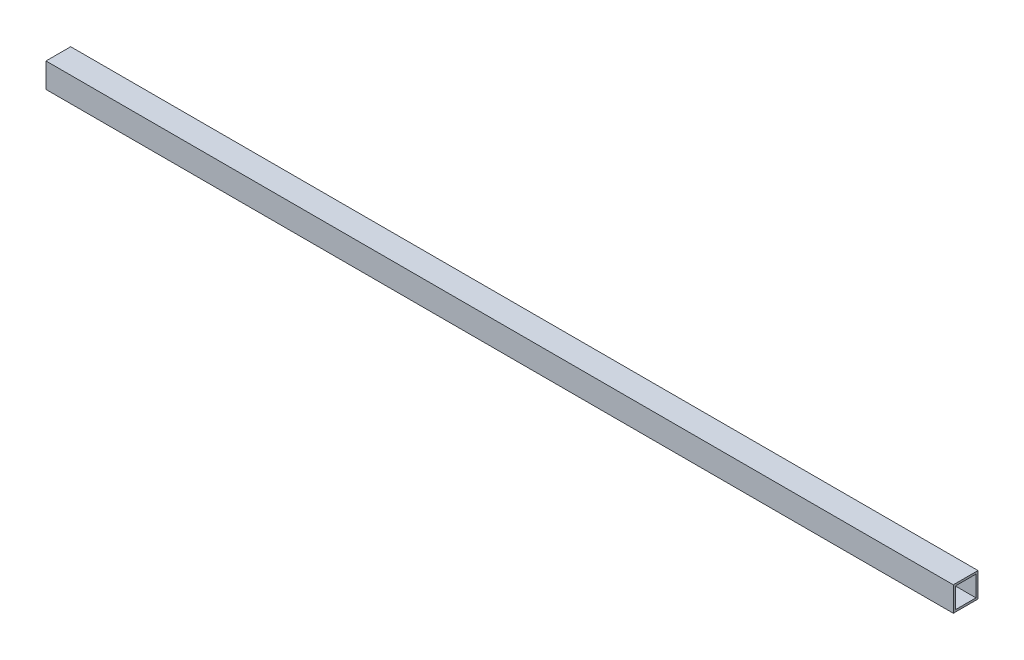
from build123d import *

# Parameters (mm, degrees)
SKETCH1_W           = 19.05
SKETCH1_H           = 19.05
SKETCH1_W_2         = 15.875
SKETCH1_H_2         = 15.875
BOSS_EXTRUDE1_DEPTH = 700


with BuildPart() as part:
    # Sketch1 → Boss-Extrude1 (new body)
    with BuildSketch(Plane(origin=(-263.380449824, 0, 0), x_dir=(0, 0, -1), z_dir=(1, 0, 0))):
        with Locations((-840.222963948, -3.994098241)):
            Rectangle(SKETCH1_W, SKETCH1_H)
        with Locations((-840.222963948, -3.994098241)):
            Rectangle(SKETCH1_W_2, SKETCH1_H_2, mode=Mode.SUBTRACT)
    extrude(amount=-BOSS_EXTRUDE1_DEPTH)


solid = part.part
